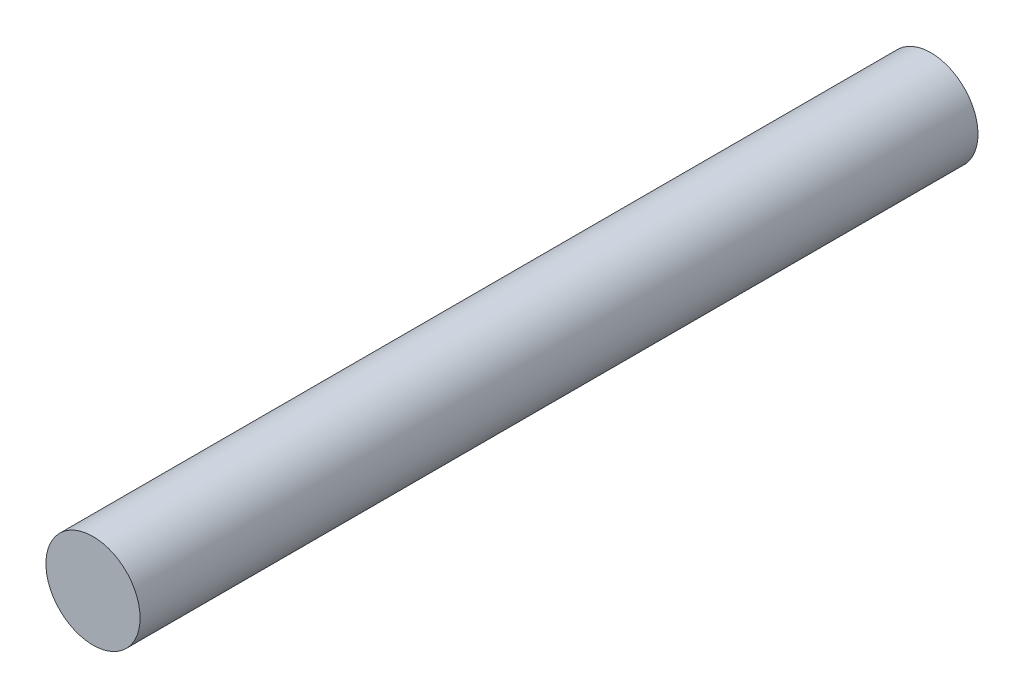
from build123d import *

# Parameters (mm, degrees)
SKETCH1_R           = 3.4
BOSS_EXTRUDE1_DEPTH = 30.25


with BuildPart() as part:
    # Sketch1 → Boss-Extrude1 (new, symmetric)
    with BuildSketch(Plane.XY):
        Circle(SKETCH1_R)
    extrude(amount=BOSS_EXTRUDE1_DEPTH, both=True)


solid = part.part
